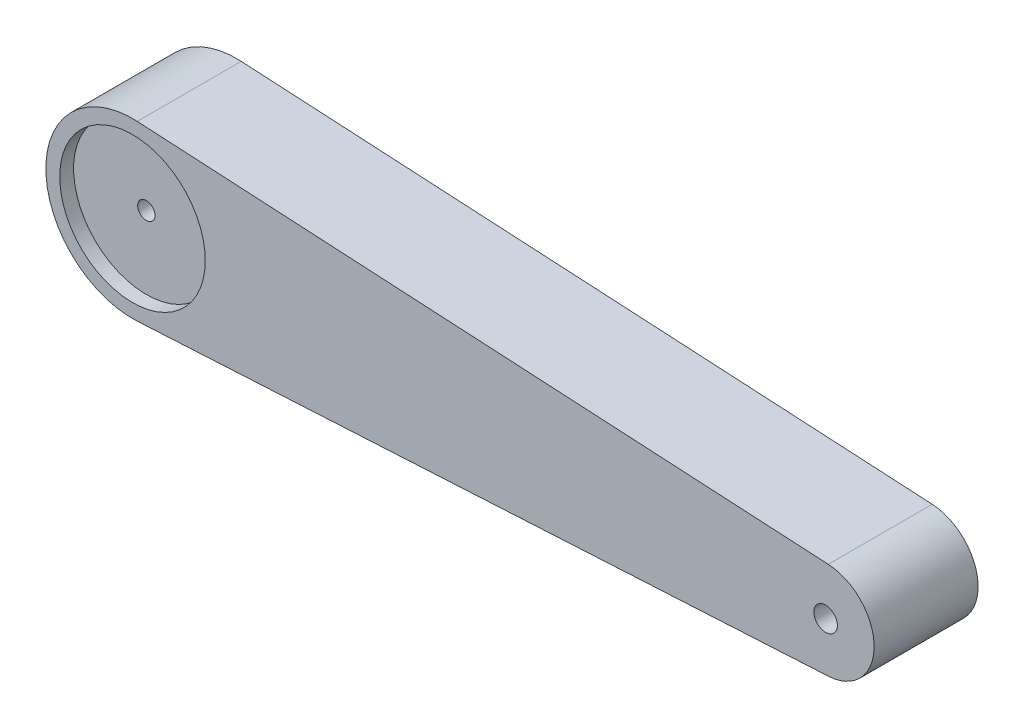
from build123d import *

# Parameters (mm, degrees)
BOSS_EXTRUDE1_DEPTH             = 15
SKETCH4_R                       = 10.5
CUT_EXTRUDE2_DEPTH              = 2
M3_CLEARANCE_HOLE2_D            = 3.4
M3X0_5_TAPPED_HOLE1_D           = 2.5
M3X0_5_TAPPED_HOLE1_CSINK_D     = 10
M3X0_5_TAPPED_HOLE1_CSINK_ANGLE = 90


with BuildPart() as part:
    # Sketch1 → Boss-Extrude1 (new body)
    with BuildSketch(Plane.XY):
        with BuildLine():
            Line((0.6875, 12.48107943), (100.385, 6.989404481))
            ThreePointArc((100.385, 6.989404481), (107, 0), (100.385, -6.989404481))
            Line((100.385, -6.989404481), (0.6875, -12.48107943))
            ThreePointArc((0.6875, -12.48107943), (-12.5, 0), (0.6875, 12.48107943))
        make_face()
    extrude(amount=BOSS_EXTRUDE1_DEPTH)

    # Sketch4 → Cut-Extrude2 (cut)
    with BuildSketch(Plane.XY.offset(15)):
        Circle(SKETCH4_R)
    extrude(amount=-CUT_EXTRUDE2_DEPTH, mode=Mode.SUBTRACT)

    # M3 Clearance Hole2 (through all)
    with Locations(Plane.XY.offset(15)):
        with Locations((100, 0)):
            Hole(M3_CLEARANCE_HOLE2_D / 2)

    # M3x0.5 Tapped Hole1 (through all)
    with Locations(Plane(origin=(0, 0, 0), x_dir=(-1, 0, 0), z_dir=(0, 0, -1))):
        with Locations((0, 0)):
            CounterSinkHole(M3X0_5_TAPPED_HOLE1_D / 2, M3X0_5_TAPPED_HOLE1_CSINK_D / 2, counter_sink_angle=M3X0_5_TAPPED_HOLE1_CSINK_ANGLE)


solid = part.part
